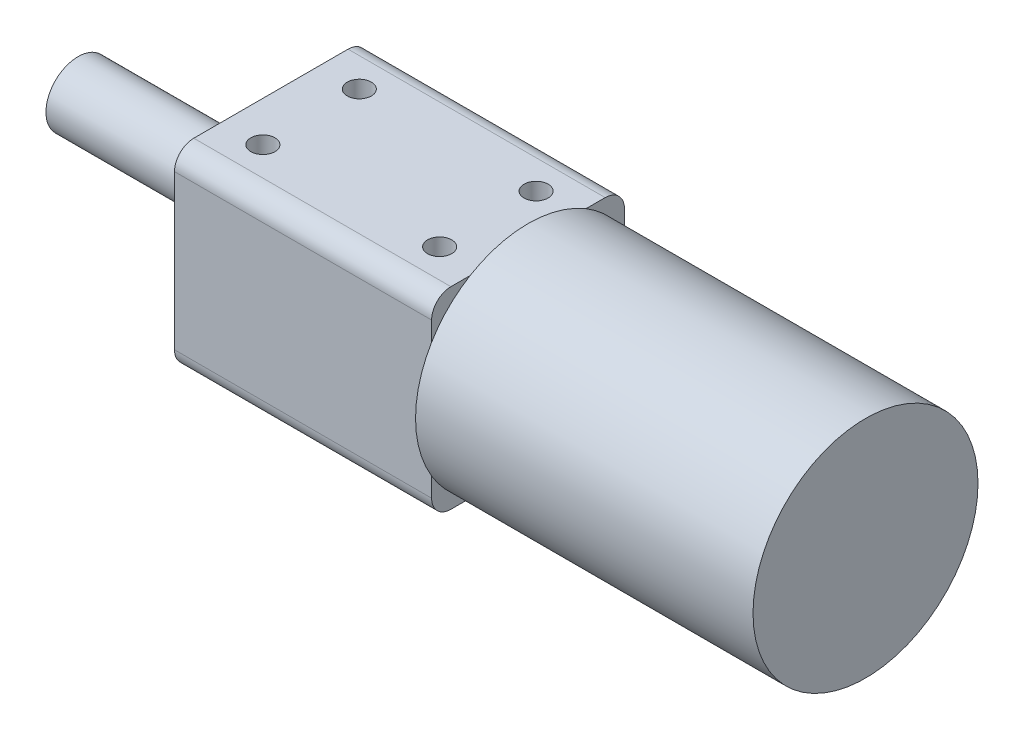
from build123d import *

# Parameters (mm, degrees)
SKETCH1_R           = 22.225
SKETCH1_R_2         = 6.35
BOSS_EXTRUDE1_DEPTH = 66.675
SKETCH1_3_W         = 38.1
SKETCH1_3_H         = 38.1
BOSS_EXTRUDE2_DEPTH = 50.8
BOSS_EXTRUDE3_START = -50.8
SKETCH1_4_R         = 6.35
BOSS_EXTRUDE3_DEPTH = 38.1
SKETCH2_R           = 2.38125
CUT_EXTRUDE1_DEPTH  = 12.7
CUT_EXTRUDE2_START  = -25.4
SKETCH2_2_R         = 2.38125
CUT_EXTRUDE2_DEPTH  = 12.7
FILLET1_R           = 3.81


with BuildPart() as part:
    # Sketch1 → Boss-Extrude1 (new body)
    with BuildSketch(Plane(origin=(0, 0, 0), x_dir=(0, 0, -1), z_dir=(1, 0, 0))):
        Circle(SKETCH1_R)
        Circle(SKETCH1_R_2)
        with BuildLine():
            ThreePointArc((11.4476253, 19.05), (0, 22.225), (-11.4476253, 19.05))
            Line((-11.4476253, 19.05), (11.4476253, 19.05))
        make_face()
        with BuildLine():
            Line((19.05, 11.4476253), (19.05, -11.4476253))
            ThreePointArc((19.05, -11.4476253), (21.416545882, -5.939881102), (22.225, 0))
            ThreePointArc((22.225, 0), (21.416545882, 5.939881102), (19.05, 11.4476253))
        make_face()
        with BuildLine():
            Line((11.4476253, -19.05), (-11.4476253, -19.05))
            ThreePointArc((-11.4476253, -19.05), (0, -22.225), (11.4476253, -19.05))
        make_face()
        with BuildLine():
            ThreePointArc((-19.05, 11.4476253), (-22.225, 0), (-19.05, -11.4476253))
            Line((-19.05, -11.4476253), (-19.05, 11.4476253))
        make_face()
    extrude(amount=BOSS_EXTRUDE1_DEPTH)

    # Sketch1<3> → Boss-Extrude2 (add)
    with BuildSketch(Plane(origin=(0, 0, 0), x_dir=(0, 0, -1), z_dir=(1, 0, 0))):
        Rectangle(SKETCH1_3_W, SKETCH1_3_H)
    extrude(amount=-BOSS_EXTRUDE2_DEPTH)

    # Sketch1<4> → Boss-Extrude3 (add)
    with BuildSketch(Plane(origin=(0, 0, 0), x_dir=(0, 0, -1), z_dir=(1, 0, 0)).offset(BOSS_EXTRUDE3_START)):
        Circle(SKETCH1_4_R)
    extrude(amount=-BOSS_EXTRUDE3_DEPTH)

    # Sketch2 → Cut-Extrude1 (cut)
    with BuildSketch(Plane(origin=(0, 19.05, 0), x_dir=(1, 0, 0), z_dir=(0, 1, 0))):
        with Locations(Location((-42.8625, 9.525, 0), (0, 0, 270))):
            Circle(SKETCH2_R)
        with Locations(Location((-7.9375, 9.525, 0), (0, 0, 270))):
            Circle(SKETCH2_R)
        with Locations(Location((-7.9375, -9.525, 0), (0, 0, 90))):
            Circle(SKETCH2_R)
        with Locations(Location((-42.8625, -9.525, 0), (0, 0, 90))):
            Circle(SKETCH2_R)
    extrude(amount=-CUT_EXTRUDE1_DEPTH, mode=Mode.SUBTRACT)

    # Sketch2<2> → Cut-Extrude2 (cut)
    with BuildSketch(Plane(origin=(0, 19.05, 0), x_dir=(1, 0, 0), z_dir=(0, 1, 0)).offset(CUT_EXTRUDE2_START)):
        with Locations(Location((-42.8625, 9.525, 0), (0, 0, 270))):
            Circle(SKETCH2_2_R)
        with Locations(Location((-7.9375, 9.525, 0), (0, 0, 270))):
            Circle(SKETCH2_2_R)
        with Locations(Location((-7.9375, -9.525, 0), (0, 0, 90))):
            Circle(SKETCH2_2_R)
        with Locations(Location((-42.8625, -9.525, 0), (0, 0, 90))):
            Circle(SKETCH2_2_R)
    extrude(amount=-CUT_EXTRUDE2_DEPTH, mode=Mode.SUBTRACT)

    # Fillet1
    fillet1_edges = [part.edges().sort_by_distance(p)[0] for p in [
        (-25.4, 19.05, 19.05),
        (-25.4, 19.05, -19.05),
        (-25.4, -19.05, -19.05),
        (-25.4, -19.05, 19.05),
    ]]
    fillet(fillet1_edges, radius=FILLET1_R)


solid = part.part
